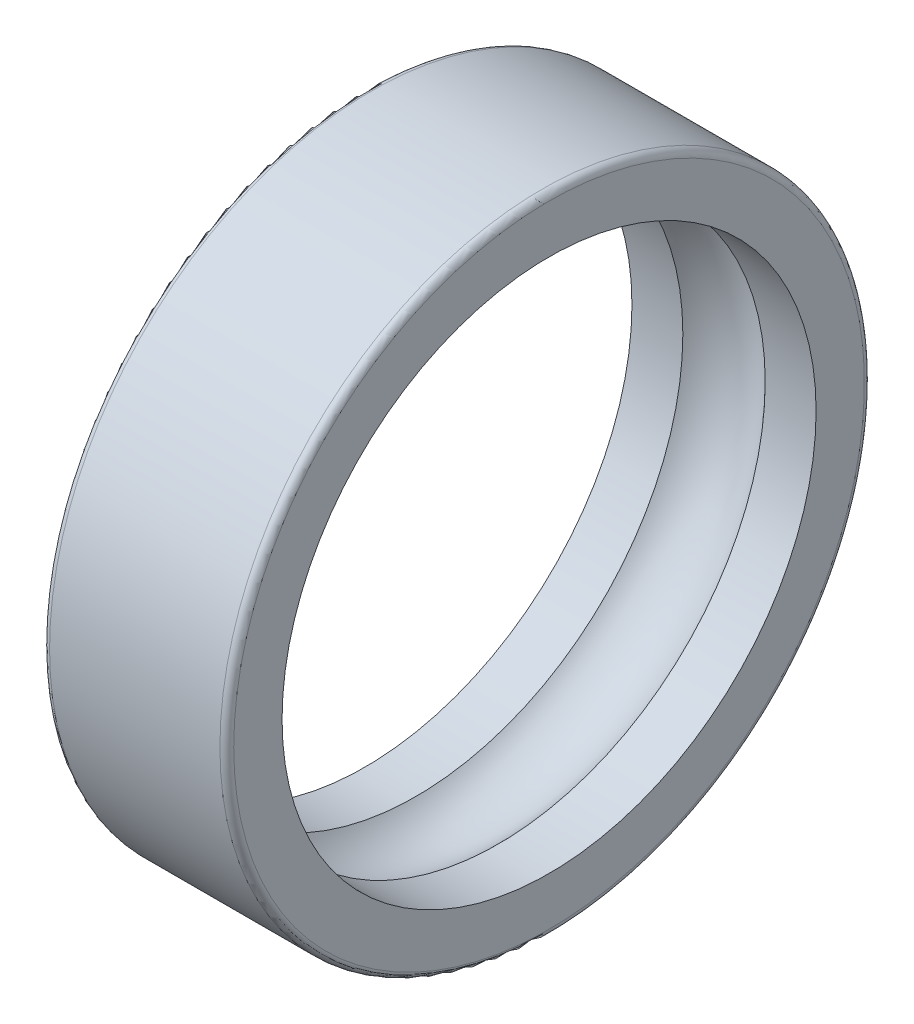
from build123d import *


with BuildPart() as part:
    # Esquisse1 → Base-Révolution (revolve)
    with BuildSketch(Plane(origin=(0, 0, 0), x_dir=(1, 0, 0), z_dir=(0, 1, 0))):
        with BuildLine():
            Line((0, 13.7), (0, 11.6))
            Line((0, 11.6), (2.211145618, 11.6))
            ThreePointArc((2.211145618, 11.6), (4, 12.4), (5.788854382, 11.6))
            Line((5.788854382, 11.6), (8, 11.6))
            Line((8, 11.6), (8, 13.7))
            ThreePointArc((8, 13.7), (7.912132034, 13.912132034), (7.7, 14))
            Line((7.7, 14), (0.3, 14))
            ThreePointArc((0.3, 14), (0.087867966, 13.912132034), (0, 13.7))
        make_face()
    revolve(axis=Axis((0, 0, 0), (1, 0, 0)))


solid = part.part
